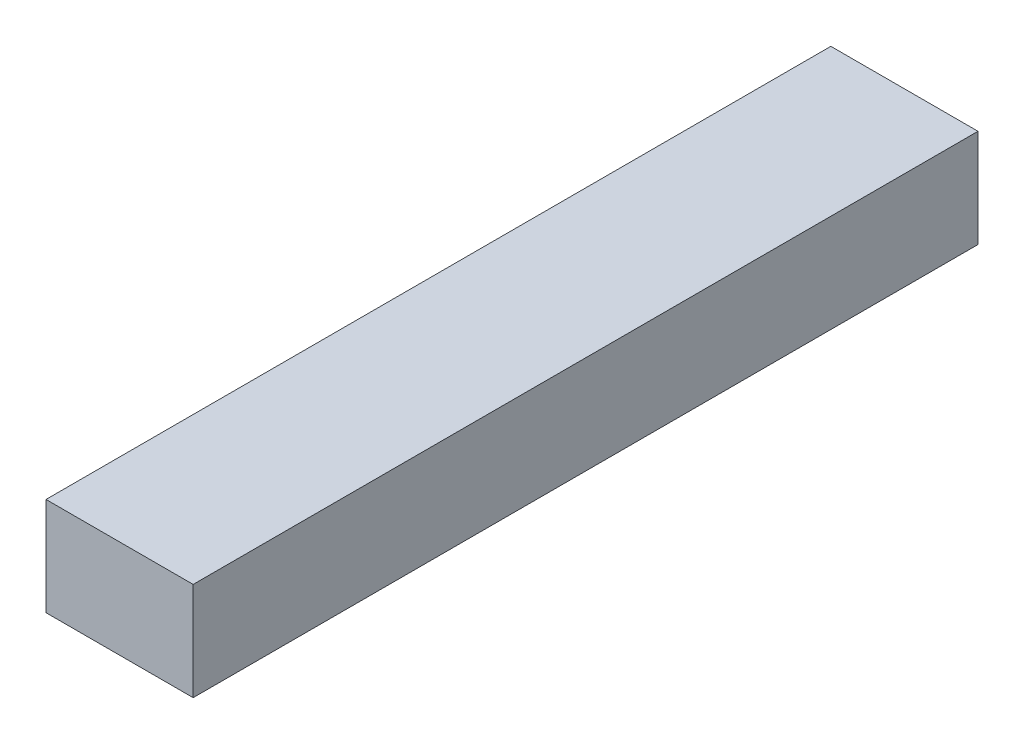
from build123d import *

# Parameters (mm, degrees)
SKIZZE1_W                       = 15
SKIZZE1_H                       = 80
AUFSATZ_LINEAR_AUSTRAGEN1_DEPTH = 10


with BuildPart() as part:
    # Skizze1 → Aufsatz-Linear austragen1 (new body)
    with BuildSketch(Plane(origin=(0, 0, 0), x_dir=(1, 0, 0), z_dir=(0, 1, 0))):
        with Locations((7.5, 40)):
            Rectangle(SKIZZE1_W, SKIZZE1_H)
    extrude(amount=AUFSATZ_LINEAR_AUSTRAGEN1_DEPTH)


solid = part.part
